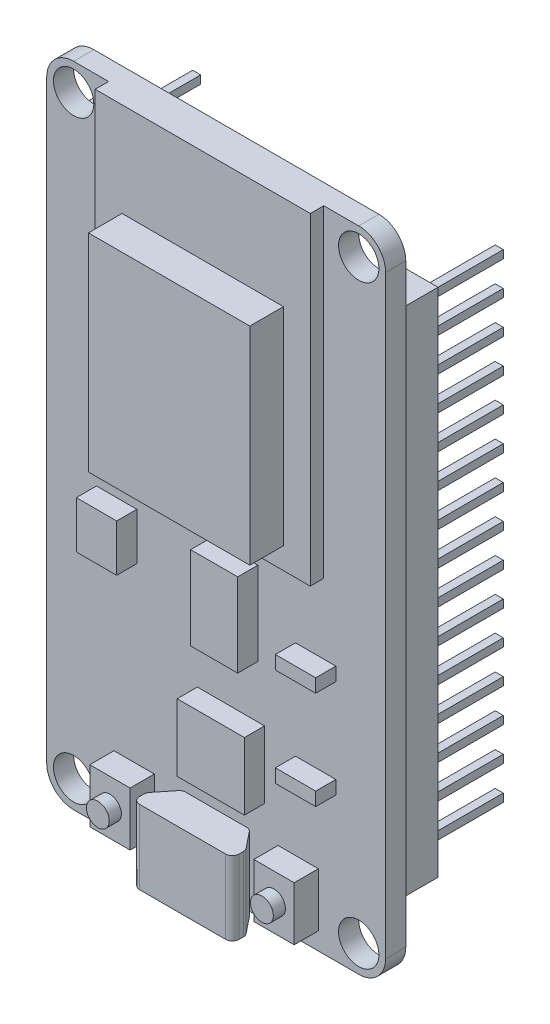
from build123d import *

# Parameters (mm, degrees)
ESQUISSE1_R                = 1.5
BOSS_EXTRU_1_DEPTH         = 1.5
ESQUISSE2_W                = 16
ESQUISSE2_H                = 24
BOSS_EXTRU_2_DEPTH         = 1
ESQUISSE3_W                = 12
ESQUISSE3_H                = 15.4
BOSS_EXTRU_3_DEPTH         = 2.5
ESQUISSE4_W                = 3
ESQUISSE4_H                = 3.5
ESQUISSE4_W_2              = 3.5
ESQUISSE4_H_2              = 6.2
ESQUISSE4_W_3              = 5
ESQUISSE4_H_3              = 5
ESQUISSE4_H_4              = 1
BOSS_EXTRU_4_DEPTH         = 1.5
ESQUISSE5_W                = 3
ESQUISSE5_H                = 4
BOSS_EXTRU_5_DEPTH         = 1.8
ESQUISSE6_R                = 0.85
BOSS_EXTRU_6_DEPTH         = 0.9
BOSS_EXTRU_7_DEPTH         = 5.5
ESQUISSE8_W                = 4
ESQUISSE8_H                = 0.3
ENL_V_MAT_EXTRU_1_DEPTH    = 4.5
ESQUISSE9_W                = 2.5
ESQUISSE9_H                = 38
BOSS_EXTRU_8_DEPTH         = 2.5
ESQUISSE10_W               = 0.6
ESQUISSE10_H               = 0.6
BOSS_EXTRU_9_DEPTH         = 5.8
R_P_TITION_LIN_AIRE1_COUNT = 15
R_P_TITION_LIN_AIRE1_PITCH = 2.5
SYM_TRIE2_COPY_1_SKETCH_W  = 0.6
SYM_TRIE2_COPY_1_SKETCH_H  = 0.6
SYM_TRIE2_COPY_1_DEPTH     = 5.8
SYM_TRIE2_COPY_2_SKETCH_W  = 0.6
SYM_TRIE2_COPY_2_SKETCH_H  = 0.6
SYM_TRIE2_COPY_2_DEPTH     = 5.8
SYM_TRIE2_COPY_3_SKETCH_W  = 0.6
SYM_TRIE2_COPY_3_SKETCH_H  = 0.6
SYM_TRIE2_COPY_3_DEPTH     = 5.8
SYM_TRIE2_COPY_4_SKETCH_W  = 0.6
SYM_TRIE2_COPY_4_SKETCH_H  = 0.6
SYM_TRIE2_COPY_4_DEPTH     = 5.8
SYM_TRIE2_COPY_5_SKETCH_W  = 0.6
SYM_TRIE2_COPY_5_SKETCH_H  = 0.6
SYM_TRIE2_COPY_5_DEPTH     = 5.8
SYM_TRIE2_COPY_6_SKETCH_W  = 0.6
SYM_TRIE2_COPY_6_SKETCH_H  = 0.6
SYM_TRIE2_COPY_6_DEPTH     = 5.8
SYM_TRIE2_COPY_7_SKETCH_W  = 0.6
SYM_TRIE2_COPY_7_SKETCH_H  = 0.6
SYM_TRIE2_COPY_7_DEPTH     = 5.8
SYM_TRIE2_COPY_8_SKETCH_W  = 0.6
SYM_TRIE2_COPY_8_SKETCH_H  = 0.6
SYM_TRIE2_COPY_8_DEPTH     = 5.8
SYM_TRIE2_COPY_9_SKETCH_W  = 0.6
SYM_TRIE2_COPY_9_SKETCH_H  = 0.6
SYM_TRIE2_COPY_9_DEPTH     = 5.8
SYM_TRIE2_COPY_10_SKETCH_W = 0.6
SYM_TRIE2_COPY_10_SKETCH_H = 0.6
SYM_TRIE2_COPY_10_DEPTH    = 5.8
SYM_TRIE2_COPY_11_SKETCH_W = 0.6
SYM_TRIE2_COPY_11_SKETCH_H = 0.6
SYM_TRIE2_COPY_11_DEPTH    = 5.8
SYM_TRIE2_COPY_12_SKETCH_W = 0.6
SYM_TRIE2_COPY_12_SKETCH_H = 0.6
SYM_TRIE2_COPY_12_DEPTH    = 5.8
SYM_TRIE2_COPY_13_SKETCH_W = 0.6
SYM_TRIE2_COPY_13_SKETCH_H = 0.6
SYM_TRIE2_COPY_13_DEPTH    = 5.8
SYM_TRIE2_COPY_14_SKETCH_W = 0.6
SYM_TRIE2_COPY_14_SKETCH_H = 0.6
SYM_TRIE2_COPY_14_DEPTH    = 5.8


with BuildPart() as part:
    # Esquisse1 → Boss.-Extru.1 (new body)
    with BuildSketch(Plane.XY):
        with BuildLine():
            Line((-10.6, -24.1), (10.6, -24.1))
            ThreePointArc((10.6, -24.1), (12.014213562, -23.514213562), (12.6, -22.1))
            Line((12.6, -22.1), (12.6, 22.1))
            ThreePointArc((12.6, 22.1), (12.014213562, 23.514213562), (10.6, 24.1))
            Line((10.6, 24.1), (-10.6, 24.1))
            ThreePointArc((-10.6, 24.1), (-12.014213562, 23.514213562), (-12.6, 22.1))
            Line((-12.6, 22.1), (-12.6, -22.1))
            ThreePointArc((-12.6, -22.1), (-12.014213562, -23.514213562), (-10.6, -24.1))
        make_face()
        with Locations((-10.6, 22.1)):
            Circle(ESQUISSE1_R, mode=Mode.SUBTRACT)
        with Locations((10.6, 22.1)):
            Circle(ESQUISSE1_R, mode=Mode.SUBTRACT)
        with Locations((-10.6, -22.1)):
            Circle(ESQUISSE1_R, mode=Mode.SUBTRACT)
        with Locations((10.6, -22.1)):
            Circle(ESQUISSE1_R, mode=Mode.SUBTRACT)
    extrude(amount=BOSS_EXTRU_1_DEPTH)

    # Esquisse2 → Boss.-Extru.2 (add)
    with BuildSketch(Plane.XY.offset(1.5)):
        with Locations((0, 12.1)):
            Rectangle(ESQUISSE2_W, ESQUISSE2_H)
    extrude(amount=BOSS_EXTRU_2_DEPTH)

    # Esquisse3 → Boss.-Extru.3 (add)
    with BuildSketch(Plane.XY.offset(2.5)):
        with Locations((0, 9.4)):
            Rectangle(ESQUISSE3_W, ESQUISSE3_H)
    extrude(amount=BOSS_EXTRU_3_DEPTH)

    # Esquisse4 → Boss.-Extru.4 (add)
    with BuildSketch(Plane.XY.offset(1.5)):
        with Locations((-7.4, -4.15)):
            Rectangle(ESQUISSE4_W, ESQUISSE4_H)
        with Locations((1.35, -4.6)):
            Rectangle(ESQUISSE4_W_2, ESQUISSE4_H_2)
        with Locations((1.1, -14.1)):
            Rectangle(ESQUISSE4_W_3, ESQUISSE4_H_3)
        with Locations((7.4, -5.6)):
            Rectangle(ESQUISSE4_W, ESQUISSE4_H_4)
        with Locations((7.4, -12.9)):
            Rectangle(ESQUISSE4_W, ESQUISSE4_H_4)
    extrude(amount=BOSS_EXTRU_4_DEPTH)

    # Esquisse5 → Boss.-Extru.5 (add)
    with BuildSketch(Plane.XY.offset(1.5)):
        with Locations((-6.1, -20.8)):
            Rectangle(ESQUISSE5_W, ESQUISSE5_H)
    boss_extru_5 = extrude(amount=BOSS_EXTRU_5_DEPTH)

    # Esquisse6 → Boss.-Extru.6 (add)
    with BuildSketch(Plane.XY.offset(3.3)):
        with Locations((-6.1, -20.8)):
            Circle(ESQUISSE6_R)
    boss_extru_6 = extrude(amount=BOSS_EXTRU_6_DEPTH)

    # Symétrie1: Boss.-Extru.5, Boss.-Extru.6 across plane
    add(boss_extru_5.mirror(Plane(origin=(0, 0, 0), x_dir=(0, 0, 1), z_dir=(1, 0, 0))))
    add(boss_extru_6.mirror(Plane(origin=(0, 0, 0), x_dir=(0, 0, 1), z_dir=(1, 0, 0))))

    # Esquisse7 → Boss.-Extru.7 (add)
    with BuildSketch(Plane(origin=(0, -18.8, 0), x_dir=(1, 0, 0), z_dir=(0, 1, 0))):
        with BuildLine():
            Line((-3.2, -4), (3.2, -4))
            ThreePointArc((3.2, -4), (3.553553391, -3.853553391), (3.7, -3.5))
            Line((3.7, -3.5), (3.7, -3.17539053))
            ThreePointArc((3.7, -3.17539053), (3.67181416, -3.009887059), (3.590434405, -2.863043006))
            Line((3.590434405, -2.863043006), (2.650121981, -1.687652476))
            ThreePointArc((2.650121981, -1.687652476), (2.476281942, -1.549348382), (2.259687576, -1.5))
            Line((2.259687576, -1.5), (-2.259687576, -1.5))
            ThreePointArc((-2.259687576, -1.5), (-2.476281942, -1.549348382), (-2.650121981, -1.687652476))
            Line((-2.650121981, -1.687652476), (-3.590434405, -2.863043006))
            ThreePointArc((-3.590434405, -2.863043006), (-3.67181416, -3.009887059), (-3.7, -3.17539053))
            Line((-3.7, -3.17539053), (-3.7, -3.5))
            ThreePointArc((-3.7, -3.5), (-3.553553391, -3.853553391), (-3.2, -4))
        make_face()
    extrude(amount=-BOSS_EXTRU_7_DEPTH)

    # Esquisse8 → Enlèv. mat.-Extru.1 (cut)
    with BuildSketch(Plane.XZ.offset(24.3)):
        with BuildLine():
            Line((-3.5, 3.5), (-3.5, 3.17539053))
            ThreePointArc((-3.5, 3.17539053), (-3.483088496, 3.076088447), (-3.434260643, 2.987982015))
            Line((-3.434260643, 2.987982015), (-2.493948219, 1.812591486))
            ThreePointArc((-2.493948219, 1.812591486), (-2.389644195, 1.729609029), (-2.259687576, 1.7))
            Line((-2.259687576, 1.7), (2.259687576, 1.7))
            ThreePointArc((2.259687576, 1.7), (2.389644195, 1.729609029), (2.493948219, 1.812591486))
            Line((2.493948219, 1.812591486), (3.434260643, 2.987982015))
            ThreePointArc((3.434260643, 2.987982015), (3.483088496, 3.076088447), (3.5, 3.17539053))
            Line((3.5, 3.17539053), (3.5, 3.5))
            ThreePointArc((3.5, 3.5), (3.412132034, 3.712132034), (3.2, 3.8))
            Line((3.2, 3.8), (-3.2, 3.8))
            ThreePointArc((-3.2, 3.8), (-3.412132034, 3.712132034), (-3.5, 3.5))
        make_face()
        with Locations((0, 2.95)):
            Rectangle(ESQUISSE8_W, ESQUISSE8_H, mode=Mode.SUBTRACT)
    extrude(amount=-ENL_V_MAT_EXTRU_1_DEPTH, mode=Mode.SUBTRACT)

    # Esquisse9 → Boss.-Extru.8 (add)
    with BuildSketch(Plane(origin=(0, 0, 0), x_dir=(-1, 0, 0), z_dir=(0, 0, -1))):
        with Locations((-11.25, 0.1)):
            Rectangle(ESQUISSE9_W, ESQUISSE9_H)
    boss_extru_8 = extrude(amount=BOSS_EXTRU_8_DEPTH)

    # Esquisse10 → Boss.-Extru.9 (add)
    with BuildSketch(Plane(origin=(0, 0, -2.5), x_dir=(-1, 0, 0), z_dir=(0, 0, -1))):
        with Locations((-11.25, 17.85)):
            Rectangle(ESQUISSE10_W, ESQUISSE10_H)
    boss_extru_9 = extrude(amount=BOSS_EXTRU_9_DEPTH)

    # Répétition linéaire1: Boss.-Extru.9 ×15
    with Locations(*[(0, -i * R_P_TITION_LIN_AIRE1_PITCH, 0) for i in range(1, R_P_TITION_LIN_AIRE1_COUNT)]):
        add(boss_extru_9)

    # Symétrie2: Boss.-Extru.8, Boss.-Extru.9 across plane
    add(boss_extru_8.mirror(Plane(origin=(0, 0, 0), x_dir=(0, 0, 1), z_dir=(1, 0, 0))))
    add(boss_extru_9.mirror(Plane(origin=(0, 0, 0), x_dir=(0, 0, 1), z_dir=(1, 0, 0))))

    # Symétrie2 copy 1 sketch → Symétrie2 copy 1 (add)
    with BuildSketch(Plane(origin=(0, -2.5, -2.5), x_dir=(1, 0, 0), z_dir=(0, 0, -1))):
        with Locations((-11.25, -17.85)):
            Rectangle(SYM_TRIE2_COPY_1_SKETCH_W, SYM_TRIE2_COPY_1_SKETCH_H)
    extrude(amount=SYM_TRIE2_COPY_1_DEPTH)

    # Symétrie2 copy 2 sketch → Symétrie2 copy 2 (add)
    with BuildSketch(Plane(origin=(0, -5, -2.5), x_dir=(1, 0, 0), z_dir=(0, 0, -1))):
        with Locations((-11.25, -17.85)):
            Rectangle(SYM_TRIE2_COPY_2_SKETCH_W, SYM_TRIE2_COPY_2_SKETCH_H)
    extrude(amount=SYM_TRIE2_COPY_2_DEPTH)

    # Symétrie2 copy 3 sketch → Symétrie2 copy 3 (add)
    with BuildSketch(Plane(origin=(0, -7.5, -2.5), x_dir=(1, 0, 0), z_dir=(0, 0, -1))):
        with Locations((-11.25, -17.85)):
            Rectangle(SYM_TRIE2_COPY_3_SKETCH_W, SYM_TRIE2_COPY_3_SKETCH_H)
    extrude(amount=SYM_TRIE2_COPY_3_DEPTH)

    # Symétrie2 copy 4 sketch → Symétrie2 copy 4 (add)
    with BuildSketch(Plane(origin=(0, -10, -2.5), x_dir=(1, 0, 0), z_dir=(0, 0, -1))):
        with Locations((-11.25, -17.85)):
            Rectangle(SYM_TRIE2_COPY_4_SKETCH_W, SYM_TRIE2_COPY_4_SKETCH_H)
    extrude(amount=SYM_TRIE2_COPY_4_DEPTH)

    # Symétrie2 copy 5 sketch → Symétrie2 copy 5 (add)
    with BuildSketch(Plane(origin=(0, -12.5, -2.5), x_dir=(1, 0, 0), z_dir=(0, 0, -1))):
        with Locations((-11.25, -17.85)):
            Rectangle(SYM_TRIE2_COPY_5_SKETCH_W, SYM_TRIE2_COPY_5_SKETCH_H)
    extrude(amount=SYM_TRIE2_COPY_5_DEPTH)

    # Symétrie2 copy 6 sketch → Symétrie2 copy 6 (add)
    with BuildSketch(Plane(origin=(0, -15, -2.5), x_dir=(1, 0, 0), z_dir=(0, 0, -1))):
        with Locations((-11.25, -17.85)):
            Rectangle(SYM_TRIE2_COPY_6_SKETCH_W, SYM_TRIE2_COPY_6_SKETCH_H)
    extrude(amount=SYM_TRIE2_COPY_6_DEPTH)

    # Symétrie2 copy 7 sketch → Symétrie2 copy 7 (add)
    with BuildSketch(Plane(origin=(0, -17.5, -2.5), x_dir=(1, 0, 0), z_dir=(0, 0, -1))):
        with Locations((-11.25, -17.85)):
            Rectangle(SYM_TRIE2_COPY_7_SKETCH_W, SYM_TRIE2_COPY_7_SKETCH_H)
    extrude(amount=SYM_TRIE2_COPY_7_DEPTH)

    # Symétrie2 copy 8 sketch → Symétrie2 copy 8 (add)
    with BuildSketch(Plane(origin=(0, -20, -2.5), x_dir=(1, 0, 0), z_dir=(0, 0, -1))):
        with Locations((-11.25, -17.85)):
            Rectangle(SYM_TRIE2_COPY_8_SKETCH_W, SYM_TRIE2_COPY_8_SKETCH_H)
    extrude(amount=SYM_TRIE2_COPY_8_DEPTH)

    # Symétrie2 copy 9 sketch → Symétrie2 copy 9 (add)
    with BuildSketch(Plane(origin=(0, -22.5, -2.5), x_dir=(1, 0, 0), z_dir=(0, 0, -1))):
        with Locations((-11.25, -17.85)):
            Rectangle(SYM_TRIE2_COPY_9_SKETCH_W, SYM_TRIE2_COPY_9_SKETCH_H)
    extrude(amount=SYM_TRIE2_COPY_9_DEPTH)

    # Symétrie2 copy 10 sketch → Symétrie2 copy 10 (add)
    with BuildSketch(Plane(origin=(0, -25, -2.5), x_dir=(1, 0, 0), z_dir=(0, 0, -1))):
        with Locations((-11.25, -17.85)):
            Rectangle(SYM_TRIE2_COPY_10_SKETCH_W, SYM_TRIE2_COPY_10_SKETCH_H)
    extrude(amount=SYM_TRIE2_COPY_10_DEPTH)

    # Symétrie2 copy 11 sketch → Symétrie2 copy 11 (add)
    with BuildSketch(Plane(origin=(0, -27.5, -2.5), x_dir=(1, 0, 0), z_dir=(0, 0, -1))):
        with Locations((-11.25, -17.85)):
            Rectangle(SYM_TRIE2_COPY_11_SKETCH_W, SYM_TRIE2_COPY_11_SKETCH_H)
    extrude(amount=SYM_TRIE2_COPY_11_DEPTH)

    # Symétrie2 copy 12 sketch → Symétrie2 copy 12 (add)
    with BuildSketch(Plane(origin=(0, -30, -2.5), x_dir=(1, 0, 0), z_dir=(0, 0, -1))):
        with Locations((-11.25, -17.85)):
            Rectangle(SYM_TRIE2_COPY_12_SKETCH_W, SYM_TRIE2_COPY_12_SKETCH_H)
    extrude(amount=SYM_TRIE2_COPY_12_DEPTH)

    # Symétrie2 copy 13 sketch → Symétrie2 copy 13 (add)
    with BuildSketch(Plane(origin=(0, -32.5, -2.5), x_dir=(1, 0, 0), z_dir=(0, 0, -1))):
        with Locations((-11.25, -17.85)):
            Rectangle(SYM_TRIE2_COPY_13_SKETCH_W, SYM_TRIE2_COPY_13_SKETCH_H)
    extrude(amount=SYM_TRIE2_COPY_13_DEPTH)

    # Symétrie2 copy 14 sketch → Symétrie2 copy 14 (add)
    with BuildSketch(Plane(origin=(0, -35, -2.5), x_dir=(1, 0, 0), z_dir=(0, 0, -1))):
        with Locations((-11.25, -17.85)):
            Rectangle(SYM_TRIE2_COPY_14_SKETCH_W, SYM_TRIE2_COPY_14_SKETCH_H)
    extrude(amount=SYM_TRIE2_COPY_14_DEPTH)


solid = part.part
